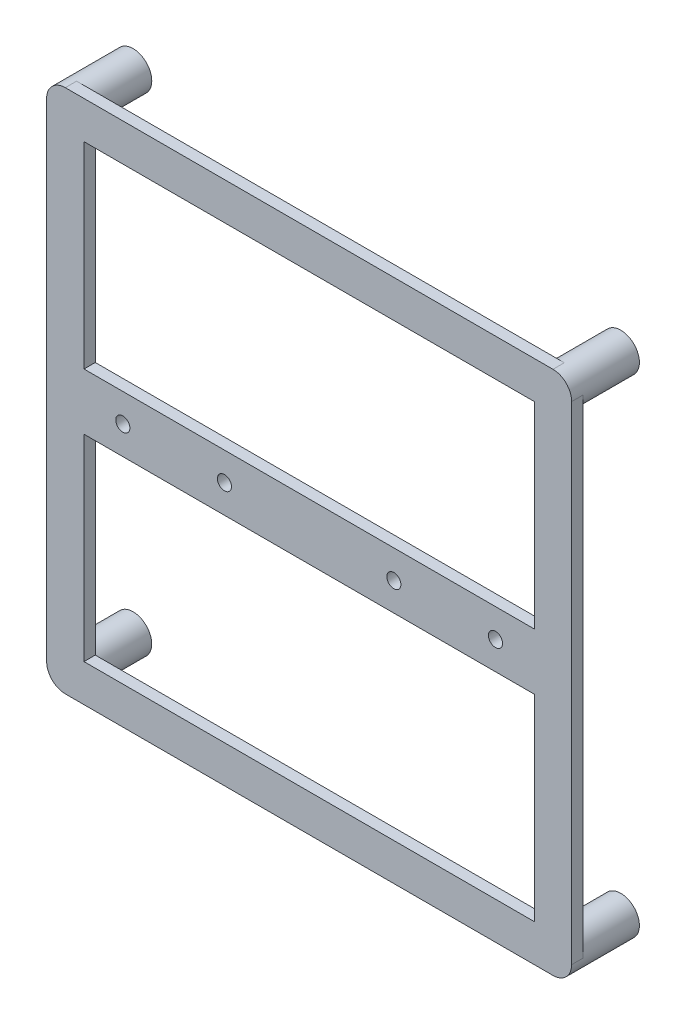
from build123d import *
from build123d.topology import SkipClean

# Parameters (mm, degrees)
SKIZZE2_R                         = 3.311754822
SKIZZE2_R_2                       = 1.25
AUFSATZ_LINEAR_AUSTRAGEN1_DEPTH   = 10
SKIZZE2_R_3                       = 3.302
AUFSATZ_LINEAR_AUSTRAGEN1_2_DEPTH = 10
AUFSATZ_LINEAR_AUSTRAGEN1_3_DEPTH = 10
AUFSATZ_LINEAR_AUSTRAGEN1_4_DEPTH = 10
AUFSATZ_LINEAR_AUSTRAGEN2_DEPTH   = 2
SKIZZE4_R                         = 1.25
SCHNITT_LINEAR_AUSTRAGEN1_DEPTH   = 2


with BuildPart() as part:
    # Skizze2 → Aufsatz-Linear austragen1 (new body)
    with BuildSketch(Plane.XY):
        with Locations((-43.18, 43.18)):
            Circle(SKIZZE2_R)
        with Locations((-43.18, 43.18)):
            Circle(SKIZZE2_R_2, mode=Mode.SUBTRACT)
    extrude(amount=AUFSATZ_LINEAR_AUSTRAGEN1_DEPTH)



with BuildPart() as body_2:
    # Skizze2 → Aufsatz-Linear austragen1 2 (new body)
    with BuildSketch(Plane.XY):
        with Locations((-43.18, -43.18)):
            Circle(SKIZZE2_R_3)
        with Locations((-43.18, -43.18)):
            Circle(SKIZZE2_R_2, mode=Mode.SUBTRACT)
    extrude(amount=AUFSATZ_LINEAR_AUSTRAGEN1_2_DEPTH)


with BuildPart() as body_3:
    # Skizze2 → Aufsatz-Linear austragen1 3 (new body)
    with BuildSketch(Plane.XY):
        with Locations((43.18, -43.18)):
            Circle(SKIZZE2_R_3)
        with Locations((43.18, -43.18)):
            Circle(SKIZZE2_R_2, mode=Mode.SUBTRACT)
    extrude(amount=AUFSATZ_LINEAR_AUSTRAGEN1_3_DEPTH)


with BuildPart() as body_4:
    # Skizze2 → Aufsatz-Linear austragen1 4 (new body)
    with BuildSketch(Plane.XY):
        with Locations((43.18, 43.18)):
            Circle(SKIZZE2_R_3)
        with Locations((43.18, 43.18)):
            Circle(SKIZZE2_R_2, mode=Mode.SUBTRACT)
    extrude(amount=AUFSATZ_LINEAR_AUSTRAGEN1_4_DEPTH)


with BuildPart() as part_1:
    with SkipClean():  # the faces are left unmerged after this step: merging them gives an invalid solid
        add(part.part)

        add(body_2.part)  # Aufsatz-Linear austragen2 merges body 2

        add(body_3.part)  # Aufsatz-Linear austragen2 merges body 3

        add(body_4.part)  # Aufsatz-Linear austragen2 merges body 4
        # Skizze3 → Aufsatz-Linear austragen2 (add)
        with BuildSketch(Plane.XY.offset(10)):
            with BuildLine():
                ThreePointArc((46.482, 43.18), (45.514866591, 45.514866591), (43.18, 46.482))
                Line((43.18, 46.482), (-43.18, 46.491754822))
                ThreePointArc((-43.18, 46.491754822), (-45.521764292, 45.521764292), (-46.491754822, 43.18))
                Line((-46.491754822, 43.18), (-46.482, -43.18))
                ThreePointArc((-46.482, -43.18), (-45.514866591, -45.514866591), (-43.18, -46.482))
                Line((-43.18, -46.482), (43.18, -46.482))
                ThreePointArc((43.18, -46.482), (45.514866591, -45.514866591), (46.482, -43.18))
                Line((46.482, -43.18), (46.482, 43.18))
            make_face()
            Polygon((39.878, -39.878), (-39.877627022, -39.878), (-39.873687387, -5.000187008), (39.878, -5.000187008), align=None, mode=Mode.SUBTRACT)
            Polygon((39.878, 39.877627022), (39.878, 4.999812928), (-39.872557834, 4.999812928), (-39.868619216, 39.868619216), align=None, mode=Mode.SUBTRACT)
        extrude(amount=AUFSATZ_LINEAR_AUSTRAGEN2_DEPTH)

    # Skizze4 → Schnitt-Linear austragen1 (cut)
    with SkipClean():  # the faces are left unmerged after this step: merging them gives an invalid solid
        with BuildSketch(Plane.XY.offset(12)):
            with Locations((-33, 0)):
                Circle(SKIZZE4_R)
            with Locations((-15, 0)):
                Circle(SKIZZE4_R)
            with Locations((32.999980451, -0.035919632)):
                Circle(SKIZZE4_R)
            with Locations((14.999991114, -0.016327105)):
                Circle(SKIZZE4_R)
        extrude(amount=-SCHNITT_LINEAR_AUSTRAGEN1_DEPTH, mode=Mode.SUBTRACT)


solid = part_1.part
